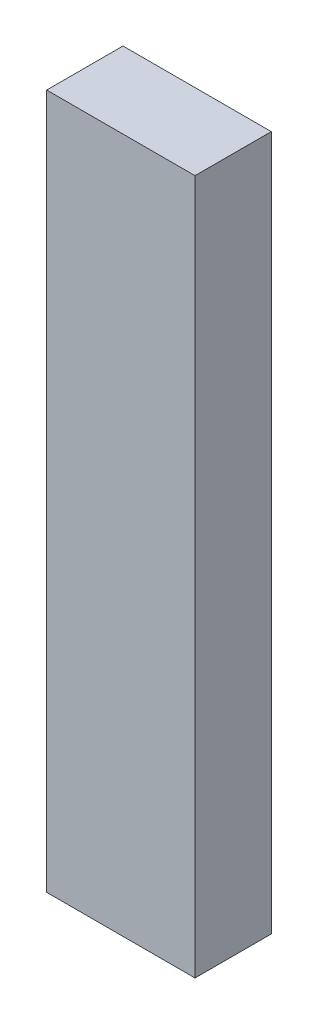
from build123d import *

# Parameters (mm, degrees)
SKETCH1_W           = 35
SKETCH1_H           = 164
BOSS_EXTRUDE1_DEPTH = 18


with BuildPart() as part:
    # Sketch1 → Boss-Extrude1 (new body)
    with BuildSketch(Plane.XY):
        Rectangle(SKETCH1_W, SKETCH1_H)
    extrude(amount=BOSS_EXTRUDE1_DEPTH)


solid = part.part
